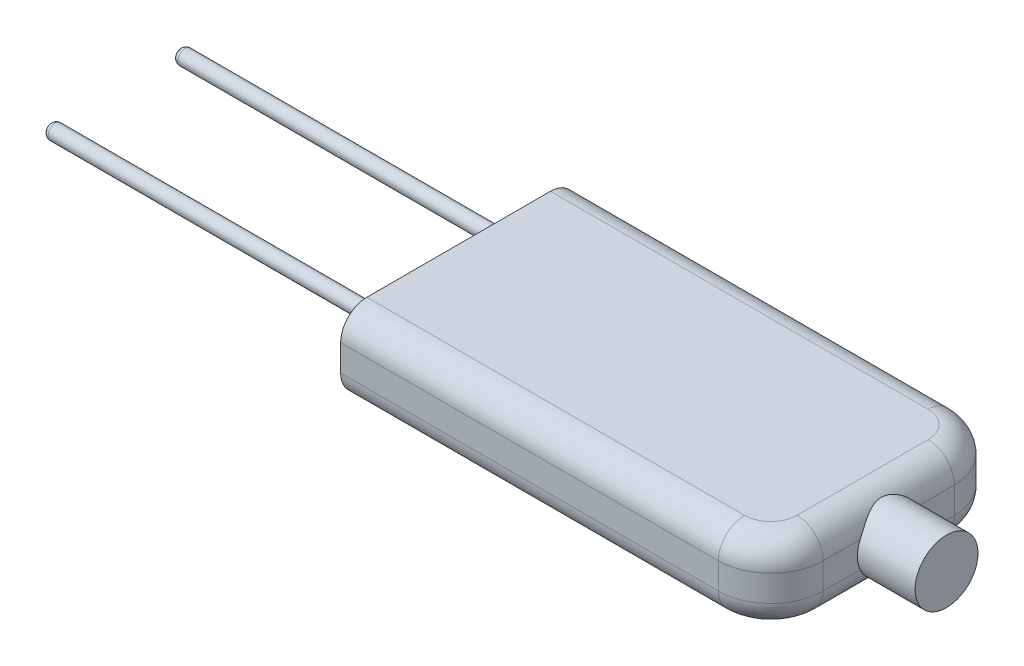
from build123d import *

# Parameters (mm, degrees)
BOSS_EXTRUDE1_DEPTH = 15
FILLET1_R           = 5
SKETCH2_R           = 6
BOSS_EXTRUDE2_DEPTH = 11
SKETCH3_R           = 1.4
BOSS_EXTRUDE3_DEPTH = 65.5
FILLET2_R           = 1


with BuildPart() as part:
    # Sketch1 → Boss-Extrude1 (new body)
    with BuildSketch(Plane(origin=(0, 0, 0), x_dir=(1, 0, 0), z_dir=(0, 1, 0))):
        with BuildLine():
            Line((0, 0), (72, 0))
            ThreePointArc((72, 0), (79.071067812, 2.928932188), (82, 10))
            Line((82, 10), (82, 35))
            ThreePointArc((82, 35), (79.071067812, 42.071067812), (72, 45))
            Line((72, 45), (0, 45))
            Line((0, 45), (0, 0))
        make_face()
    extrude(amount=BOSS_EXTRUDE1_DEPTH)

    # Fillet1
    fillet1_edges = [part.edges().sort_by_distance(p)[0] for p in [
        (79.071067812, 15, -2.928932188),
        (82, 15, -22.5),
        (79.071067812, 15, -42.071067812),
        (36, 15, -45),
        (36, 0, -45),
        (79.071067812, 0, -42.071067812),
        (82, 0, -22.5),
        (79.071067812, 0, -2.928932188),
        (36, 0, 0),
        (36, 15, 0),
    ]]
    fillet(fillet1_edges, radius=FILLET1_R)

    # Sketch2 → Boss-Extrude2 (add, symmetric)
    with BuildSketch(Plane(origin=(82, 0, 0), x_dir=(0, 0, -1), z_dir=(1, 0, 0))):
        with Locations(Location((22.5, 7.5, 0), (0, 0, 155.375681648))):
            Circle(SKETCH2_R)
    extrude(amount=BOSS_EXTRUDE2_DEPTH, both=True)

    # Sketch3 → Boss-Extrude3 (add)
    with BuildSketch(Plane.ZY):
        with Locations(Location((-34.85, 7.5, 0), (0, 0, 180))):
            Circle(SKETCH3_R)
        with Locations(Location((-10.15, 7.5, 0), (0, 0, 180))):
            Circle(SKETCH3_R)
    extrude(amount=BOSS_EXTRUDE3_DEPTH)

    # Fillet2
    fillet2_edges = [part.edges().sort_by_distance(p)[0] for p in [
        (-65.5, 7.5, -33.45),
        (-65.5, 7.5, -8.75),
    ]]
    fillet(fillet2_edges, radius=FILLET2_R)


solid = part.part
